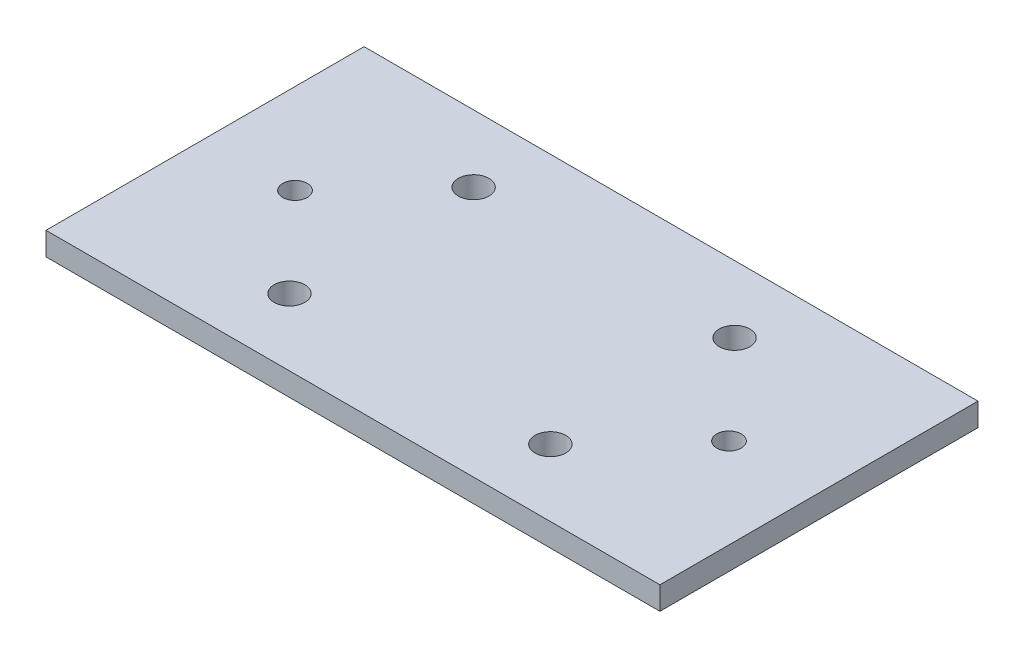
from build123d import *

# Parameters (mm, degrees)
SKETCH1_W           = 80
SKETCH1_H           = 41.449022954
SKETCH1_R           = 2
SKETCH1_R_2         = 1.6
BOSS_EXTRUDE1_DEPTH = 3


with BuildPart() as part:
    # Sketch1 → Boss-Extrude1 (new body)
    with BuildSketch(Plane(origin=(0, 0, 0), x_dir=(1, 0, 0), z_dir=(0, 1, 0))):
        with Locations((40, 20.724511477)):
            Rectangle(SKETCH1_W, SKETCH1_H)
        with Locations(Location((23, 32.724511477, 0), (0, 0, 270))):
            Circle(SKETCH1_R, mode=Mode.SUBTRACT)
        with Locations(Location((57, 32.724511477, 0), (0, 0, 270))):
            Circle(SKETCH1_R, mode=Mode.SUBTRACT)
        with Locations(Location((23, 8.724511477, 0), (0, 0, 270))):
            Circle(SKETCH1_R, mode=Mode.SUBTRACT)
        with Locations(Location((57, 8.724511477, 0), (0, 0, 270))):
            Circle(SKETCH1_R, mode=Mode.SUBTRACT)
        with Locations(Location((11.725819634, 20.724511477, 0), (0, 0, 270))):
            Circle(SKETCH1_R_2, mode=Mode.SUBTRACT)
        with Locations(Location((68.274180366, 20.724511477, 0), (0, 0, 270))):
            Circle(SKETCH1_R_2, mode=Mode.SUBTRACT)
    extrude(amount=BOSS_EXTRUDE1_DEPTH)


solid = part.part
